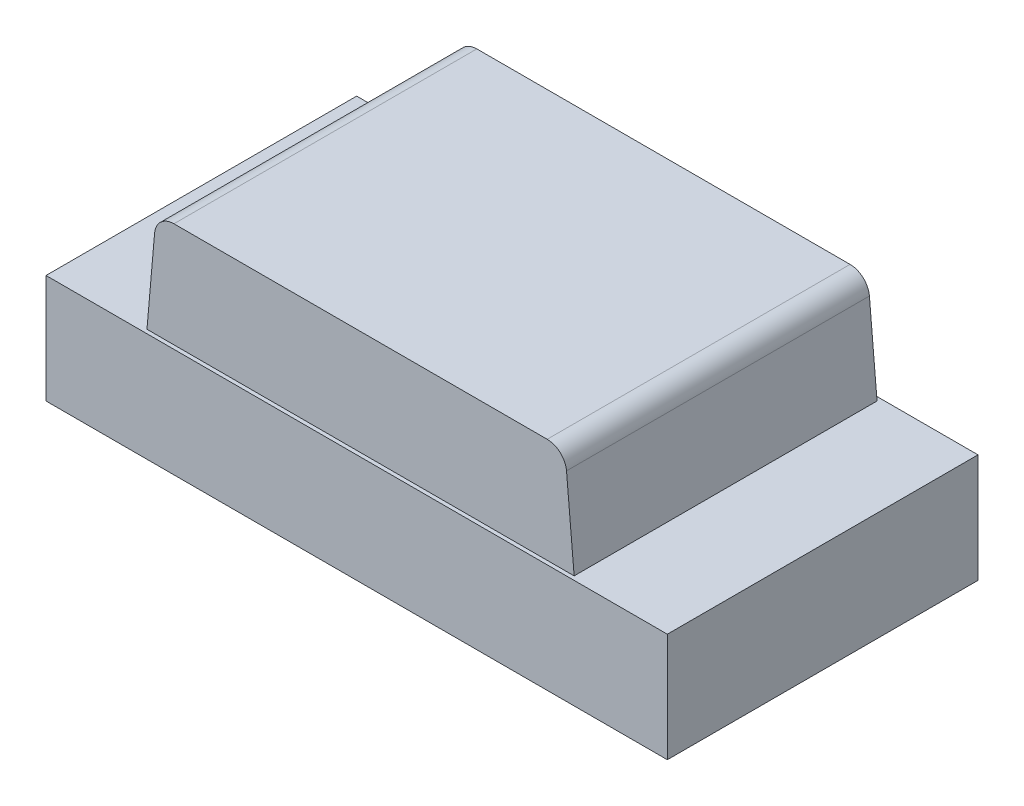
from build123d import *

# Parameters (mm, degrees)
SKETCH1_W       = 1.6
SKETCH1_H       = 0.8
BASE_DEPTH      = 0.28
LENS_DEPTH      = 0.39
LENS_DEPTH_BACK = 0.39
LENS_ROUNDS_R   = 0.05


with BuildPart() as part:
    # Sketch1 → Base (new body)
    with BuildSketch(Plane(origin=(0, 0, 0), x_dir=(1, 0, 0), z_dir=(0, 1, 0))):
        Rectangle(SKETCH1_W, SKETCH1_H)
    extrude(amount=BASE_DEPTH)

    # Sketch2 → Lens (add, two sides: drawn at the far end of the back side and taken through both)
    with BuildSketch(Plane.XY.offset(-LENS_DEPTH_BACK)):
        Polygon((-0.55, 0.28), (-0.526378061, 0.55), (0.526378061, 0.55), (0.55, 0.28), align=None)
    extrude(amount=LENS_DEPTH + LENS_DEPTH_BACK)

    # Lens Rounds
    lens_rounds_edges = [part.edges().sort_by_distance(p)[0] for p in [
        (-0.526378061, 0.55, 0),
        (0.526378061, 0.55, 0),
    ]]
    fillet(lens_rounds_edges, radius=LENS_ROUNDS_R)


solid = part.part
